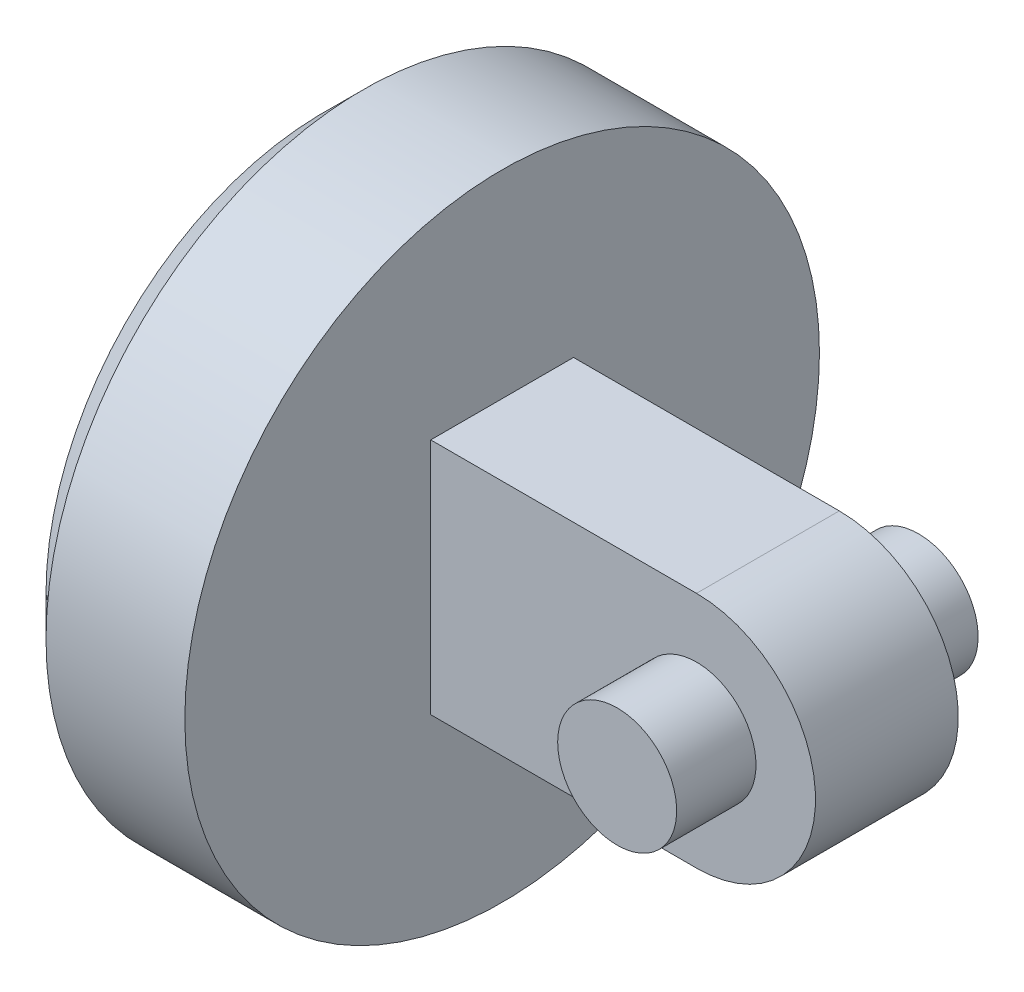
from build123d import *

# Parameters (mm, degrees)
EXTRUDE_1_DEPTH = 1.8
SKETCH_4_W      = 1.5
SKETCH_4_H      = 2


with BuildPart() as part:
    # 草图1 → 旋转1 (revolve)
    with BuildSketch(Plane.XY, mode=Mode.PRIVATE) as revolve_1_sk:
        Polygon((-4.5, 7), (-4.5, 0), (0, 0), (0, 8), (-3.5, 8), align=None)
    revolve(revolve_1_sk.sketch.rotate(Axis((-4.5, 0, 0), (1, 0, 0)), 90), axis=Axis((-4.5, 0, 0), (1, 0, 0)))

    # 草图3 → 凸台-拉伸1 (add, symmetric)
    with BuildSketch(Plane.XY):
        with BuildLine():
            Line((0, -3), (6.7, -3))
            ThreePointArc((6.7, -3), (9.7, 0), (6.7, 3))
            Line((6.7, 3), (0, 3))
            Line((0, 3), (0, -3))
        make_face()
    extrude(amount=EXTRUDE_1_DEPTH, both=True)

    # 草图4 → 旋转2 (revolve)
    with BuildSketch(Plane(origin=(0, 0, 0), x_dir=(1, 0, 0), z_dir=(0, 1, 0)), mode=Mode.PRIVATE) as revolve_2_sk:
        with Locations((7.45, -2.8)):
            Rectangle(SKETCH_4_W, SKETCH_4_H)
    revolve_2 = revolve(revolve_2_sk.sketch.rotate(Axis((6.7, 0, 1.8), (0, 0, 1)), 180), axis=Axis((6.7, 0, 1.8), (0, 0, 1)))

    # 镜向1: 旋转2 across plane
    add(revolve_2.mirror(Plane.XY))


solid = part.part
